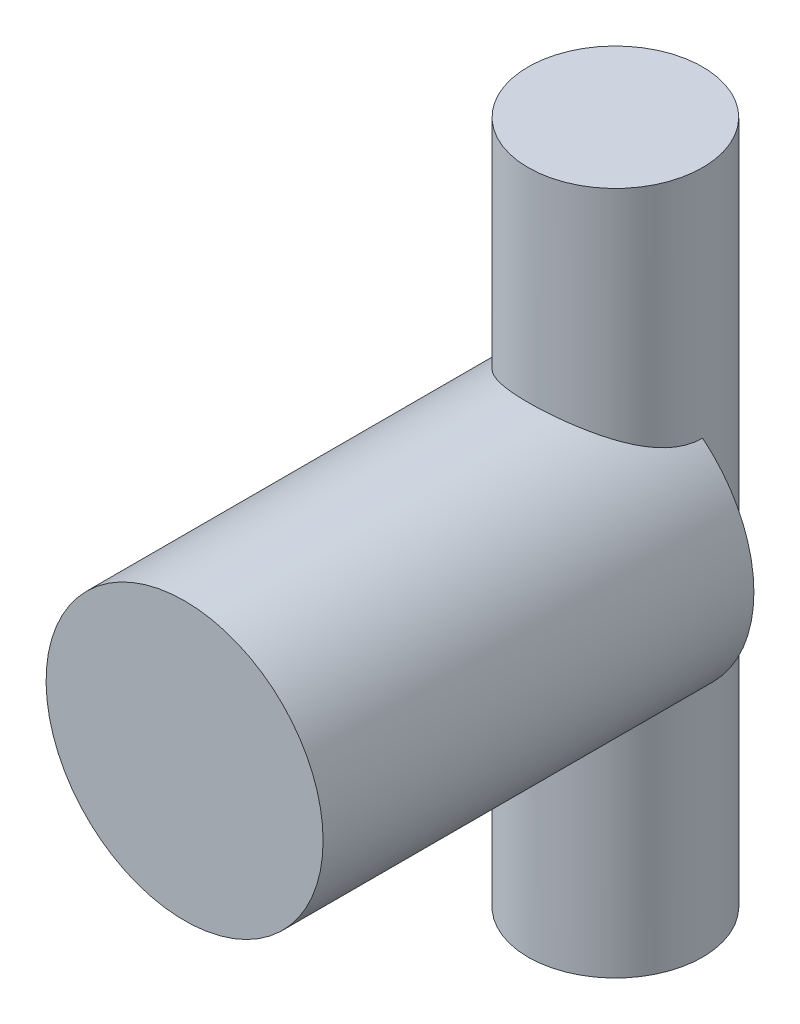
from build123d import *

# Parameters (mm, degrees)
BOSS_EXTRUDE1_DEPTH      = 31.35
BOSS_EXTRUDE1_DEPTH_BACK = 31.35
SKETCH1_R                = 8
SKETCH2_R                = 12.7
BOSS_EXTRUDE2_DEPTH      = 39.5


with BuildPart() as part:
    # Sketch1 → Boss-Extrude1 (new, two sides: drawn at the far end of the back side and taken through both)
    with BuildSketch(Plane(origin=(0, 0, 0), x_dir=(1, 0, 0), z_dir=(0, 1, 0)).offset(-BOSS_EXTRUDE1_DEPTH_BACK)):
        Circle(SKETCH1_R)
    extrude(amount=BOSS_EXTRUDE1_DEPTH + BOSS_EXTRUDE1_DEPTH_BACK)

    # Sketch2 → Boss-Extrude2 (add)
    with BuildSketch(Plane.XY):
        Circle(SKETCH2_R)
    extrude(amount=BOSS_EXTRUDE2_DEPTH)


solid = part.part
